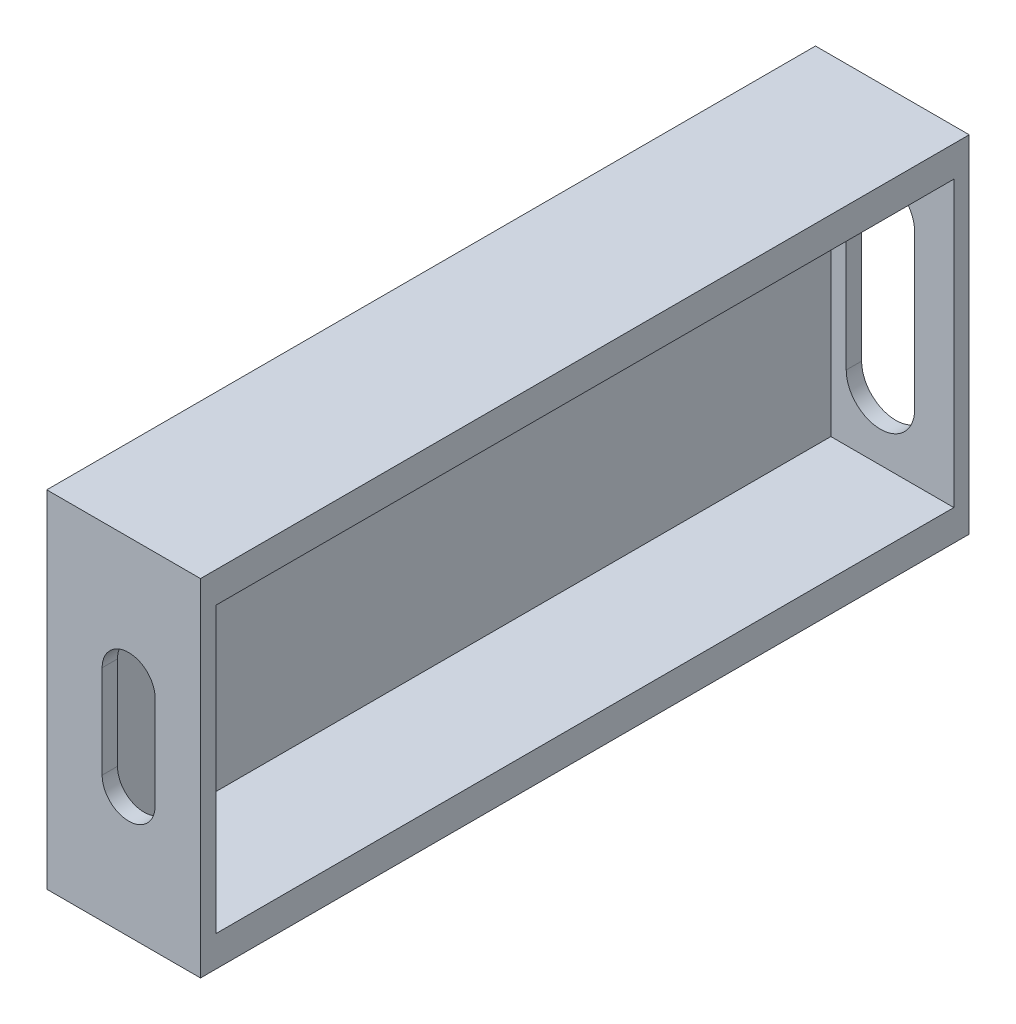
from build123d import *

# Parameters (mm, degrees)
SKETCH2_W           = 50
SKETCH2_H           = 22.5
BOSS_EXTRUDE1_DEPTH = 10
USBC_DEPTH          = 10
POGO_DEPTH          = 10
SKETCH6_W           = 48
SKETCH6_H           = 18.5
CUT_EXTRUDE3_DEPTH  = 8


with BuildPart() as part:
    # Sketch2 → Boss-Extrude1 (new body)
    with BuildSketch(Plane(origin=(0, 0, 0), x_dir=(0, 0, -1), z_dir=(1, 0, 0))):
        with Locations((25, 11.25)):
            Rectangle(SKETCH2_W, SKETCH2_H)
    extrude(amount=BOSS_EXTRUDE1_DEPTH)

    # Sketch4 → USBC (cut)
    with BuildSketch(Plane.XY):
        with BuildLine():
            Line((7.05, 14.275), (7.05, 8.225))
            ThreePointArc((7.05, 8.225), (5.325, 6.5), (3.6, 8.225))
            Line((3.6, 8.225), (3.6, 14.275))
            ThreePointArc((3.6, 14.275), (5.325, 16), (7.05, 14.275))
        make_face()
    extrude(amount=-USBC_DEPTH, mode=Mode.SUBTRACT)

    # Sketch5 → POGO (cut)
    with BuildSketch(Plane(origin=(0, 0, -50), x_dir=(-1, 0, 0), z_dir=(0, 0, -1))):
        with BuildLine():
            Line((-3, 16.25), (-3, 6.25))
            ThreePointArc((-3, 6.25), (-5.225, 4.025), (-7.45, 6.25))
            Line((-7.45, 6.25), (-7.45, 16.25))
            ThreePointArc((-7.45, 16.25), (-5.225, 18.475), (-3, 16.25))
        make_face()
    extrude(amount=-POGO_DEPTH, mode=Mode.SUBTRACT)

    # Sketch6 → Cut-Extrude3 (cut)
    with BuildSketch(Plane(origin=(10, 0, 0), x_dir=(0, 0, -1), z_dir=(1, 0, 0))):
        with Locations((25, 11.25)):
            Rectangle(SKETCH6_W, SKETCH6_H)
    extrude(amount=-CUT_EXTRUDE3_DEPTH, mode=Mode.SUBTRACT)


solid = part.part
